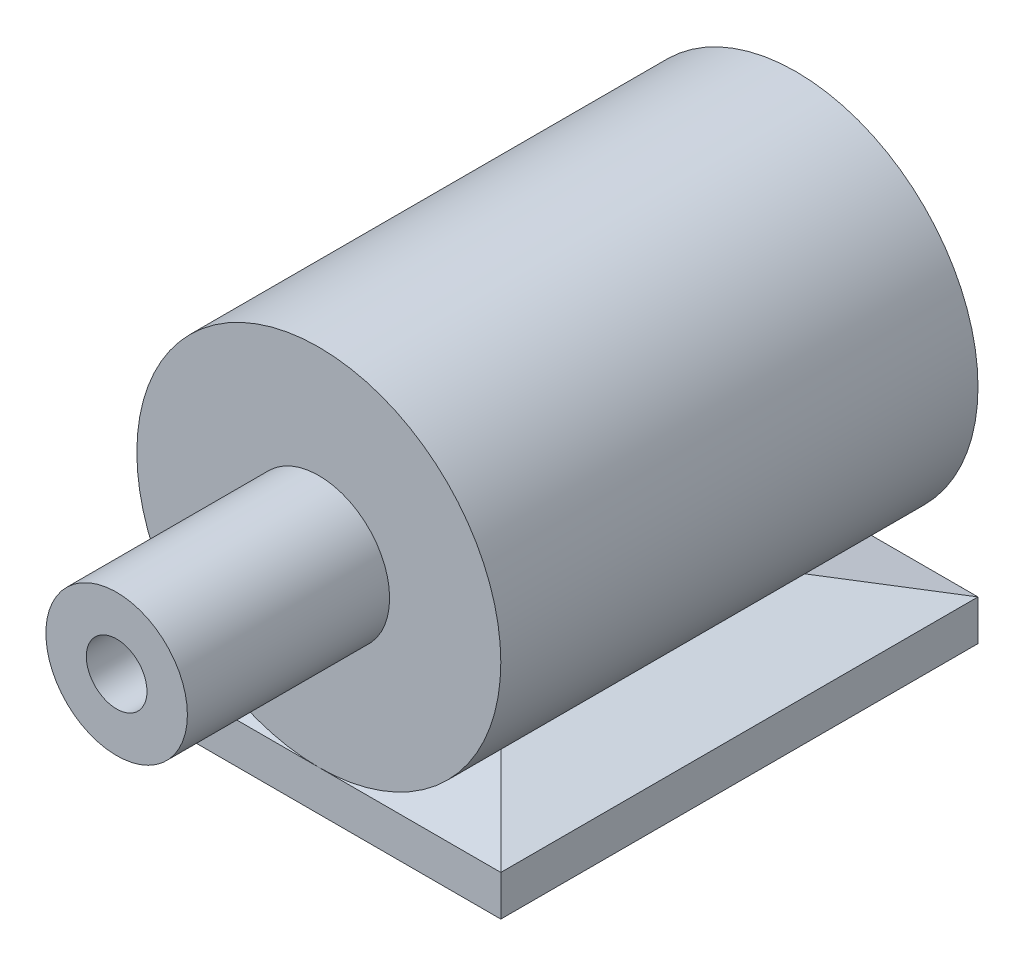
from build123d import *
from build123d.topology import SkipClean

# Parameters (mm, degrees)
SKETCH1_R                     = 45
BOSS_EXTRUDE1_DEPTH           = 118
SKETCH2_R                     = 17.5
SKETCH2_R_2                   = 7.5
BOSS_EXTRUDE2_DEPTH           = 50
SKETCH3_W                     = 90
SKETCH3_H                     = 118
BOSS_EXTRUDE3_DEPTH           = 10
SKETCH3_2_W                   = 90
SKETCH3_2_H                   = 118
BOSS_EXTRUDE4_DEPTH           = 6
BOSS_EXTRUDE4_TAPER           = 77
BOSS_EXTRUDE4_OTHER_WAY_DEPTH = 6
BOSS_EXTRUDE4_OTHER_WAY_TAPER = 77


with BuildPart() as part:
    # Sketch1 → Boss-Extrude1 (new body)
    with BuildSketch(Plane.XY):
        Circle(SKETCH1_R)
    extrude(amount=BOSS_EXTRUDE1_DEPTH)

    # Sketch2 → Boss-Extrude2 (add)
    with BuildSketch(Plane.XY.offset(118)):
        Circle(SKETCH2_R)
        Circle(SKETCH2_R_2, mode=Mode.SUBTRACT)
    extrude(amount=BOSS_EXTRUDE2_DEPTH)



with BuildPart() as body_2:
    # Sketch3 → Boss-Extrude3 (new body)
    with BuildSketch(Plane(origin=(0, -45, 0), x_dir=(-1, 0, 0), z_dir=(0, -1, 0))):
        with Locations((0, -59)):
            Rectangle(SKETCH3_W, SKETCH3_H)
    extrude(amount=BOSS_EXTRUDE3_DEPTH)


with BuildPart() as part_1:
    add(part.part)

    add(body_2.part)  # Boss-Extrude4 merges body 2
    # Sketch3<2> → Boss-Extrude4 (add)
    with BuildSketch(Plane(origin=(0, -45, 0), x_dir=(-1, 0, 0), z_dir=(0, -1, 0))):
        with Locations((0, -59)):
            Rectangle(SKETCH3_2_W, SKETCH3_2_H)
    extrude(amount=BOSS_EXTRUDE4_DEPTH, taper=BOSS_EXTRUDE4_TAPER)

    # Sketch3<2> → Boss-Extrude4 other way (add)
    with SkipClean():  # the faces are left unmerged after this step: merging them gives an invalid solid
        with BuildSketch(Plane(origin=(0, -45, 0), x_dir=(-1, 0, 0), z_dir=(0, -1, 0))):
            with Locations((0, -59)):
                Rectangle(SKETCH3_2_W, SKETCH3_2_H)
        extrude(amount=-BOSS_EXTRUDE4_OTHER_WAY_DEPTH, taper=BOSS_EXTRUDE4_OTHER_WAY_TAPER)


solid = part_1.part
